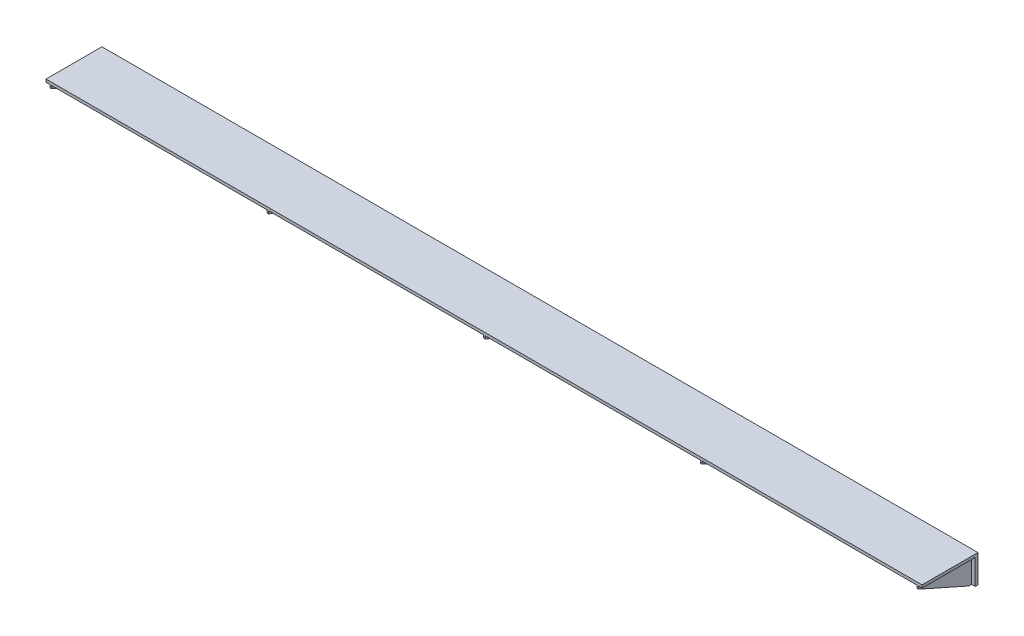
from build123d import *

# Parameters (mm, degrees)
SKETCH_1_W             = 6265.6
SKETCH_1_H             = 200
EXTRUDE_1_DEPTH        = 20
SKETCH_2_W             = 6265.6
SKETCH_2_H             = 20
EXTRUDE_2_DEPTH        = 380
EXTRUDE_START          = -30
EXTRUDE_3_DEPTH        = 10
PATTERN_LINEAR_1_COUNT = 5
PATTERN_LINEAR_1_PITCH = 1550


with BuildPart() as part:
    # 草图1 → 凸台-拉伸1 (new body)
    with BuildSketch(Plane.XY):
        Rectangle(SKETCH_1_W, SKETCH_1_H)
    extrude(amount=EXTRUDE_1_DEPTH)



with BuildPart() as body_2:
    # 草图2 → 凸台-拉伸2 (new body)
    with BuildSketch(Plane.XY.offset(20)):
        with Locations((0, 90)):
            Rectangle(SKETCH_2_W, SKETCH_2_H)
    extrude(amount=EXTRUDE_2_DEPTH)


with BuildPart() as part_1:
    add(part.part)

    add(body_2.part)  # 凸台-拉伸3 merges body 2
    # 草图3 → 凸台-拉伸3 (add)
    with BuildSketch(Plane.ZY.offset(3132.8).offset(EXTRUDE_START)):
        Polygon((400, 80), (20, 80), (20, -100), (40, -100), (400, 60), align=None)
    extrude_3 = extrude(amount=-EXTRUDE_3_DEPTH)

    # 阵列(线性)1: 凸台-拉伸3 ×5
    with Locations(*[(i * PATTERN_LINEAR_1_PITCH, 0, 0) for i in range(1, PATTERN_LINEAR_1_COUNT)]):
        add(extrude_3)


solid = part_1.part
